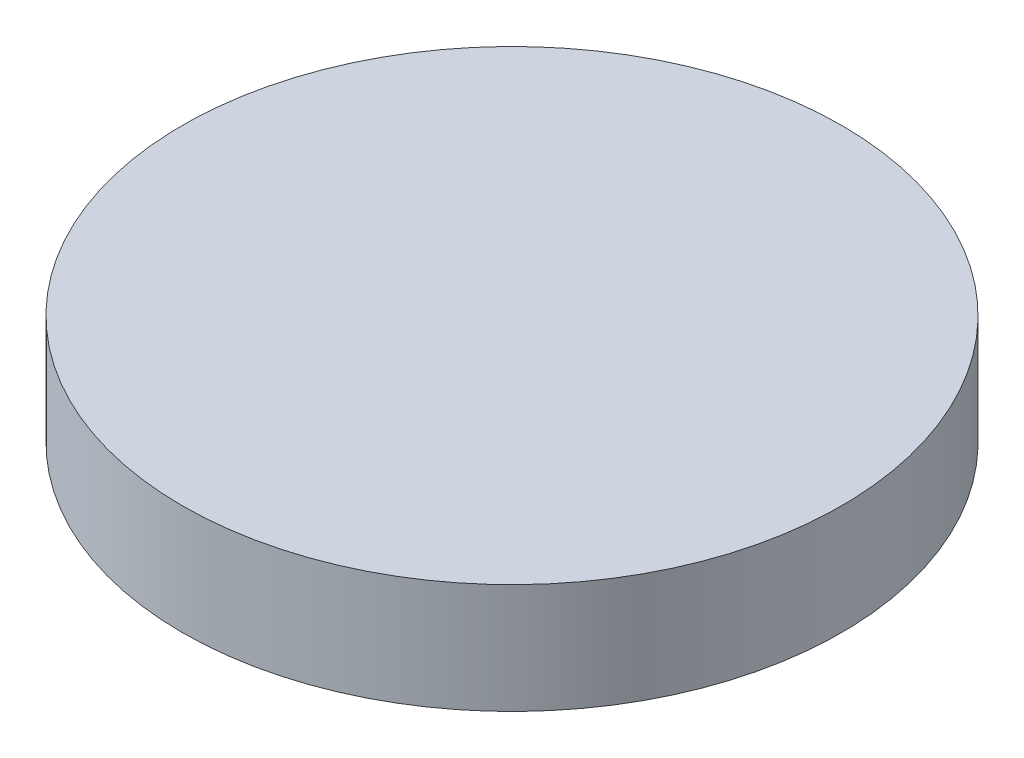
from build123d import *

# Parameters (mm, degrees)
SKETCH1_R           = 19.05
BOSS_EXTRUDE1_DEPTH = 6.35
SKETCH2_R           = 17.653
CUT_EXTRUDE1_DEPTH  = 2.8702


with BuildPart() as part:
    # Sketch1 → Boss-Extrude1 (new body)
    with BuildSketch(Plane(origin=(0, 0, 0), x_dir=(1, 0, 0), z_dir=(0, 1, 0))):
        with Locations(Location((0, 0, 0), (0, 0, 270))):
            Circle(SKETCH1_R)
    extrude(amount=BOSS_EXTRUDE1_DEPTH)

    # Sketch2 → Cut-Extrude1 (cut)
    with BuildSketch(Plane.XZ):
        with Locations(Location((0, 0, 0), (0, 0, 270))):
            Circle(SKETCH2_R)
    extrude(amount=-CUT_EXTRUDE1_DEPTH, mode=Mode.SUBTRACT)


solid = part.part
